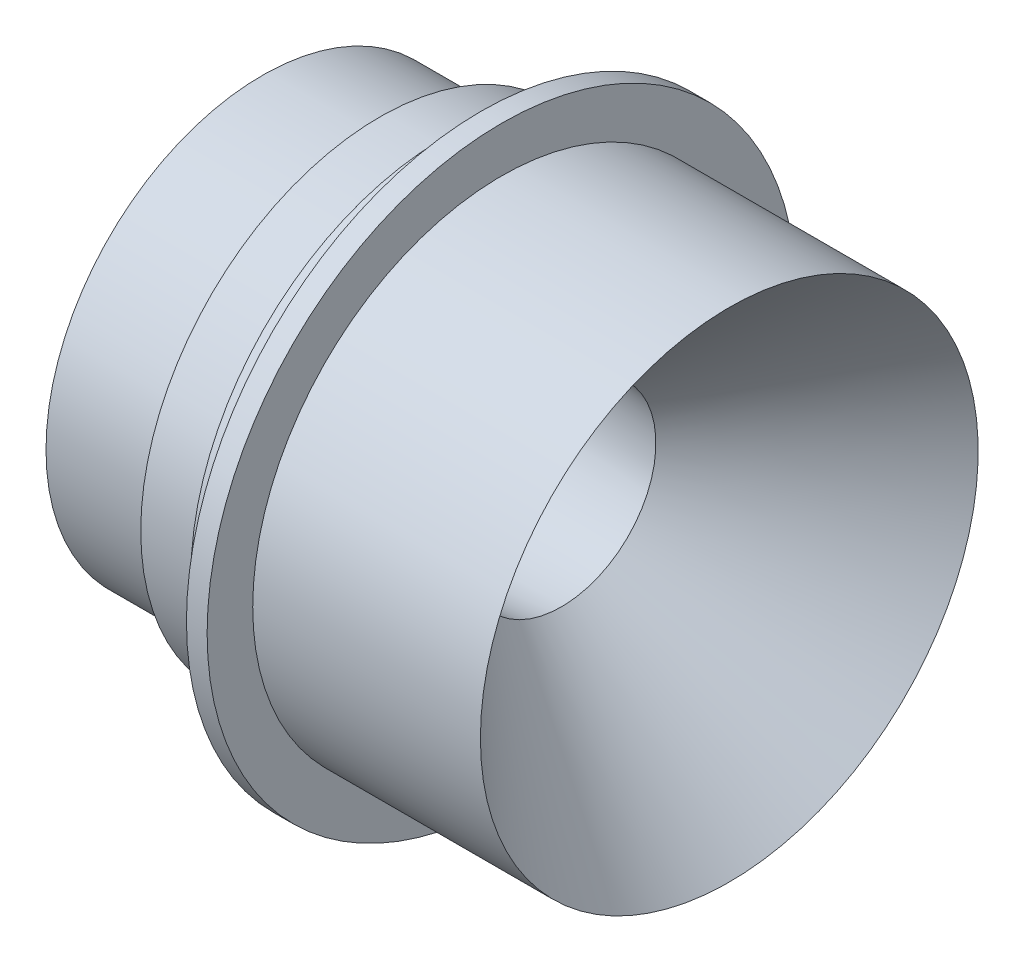
from build123d import *


with BuildPart() as part:
    # Sketch1 → Revolve1 (revolve)
    with BuildSketch(Plane.XY, mode=Mode.PRIVATE) as revolve1_sk:
        Polygon((-36.549930259, 18.971348401), (-36.549930259, 36.1315), (-16.90013245, 36.1315), (-16.90013245, 39.94765894), (-6.178543046, 39.94765894), (-6.178543046, 42.288238411), (0, 42.288238411), (0, 49.2125), (3.455069741, 49.2125), (3.455069741, 41.5925), (41.502721041, 41.5925), (13.447417219, 15.787996689), align=None)
    revolve(revolve1_sk.sketch.rotate(Axis((-46.157350993, 0, 0), (1, 0, 0)), 90), axis=Axis((-46.157350993, 0, 0), (1, 0, 0)))


solid = part.part
